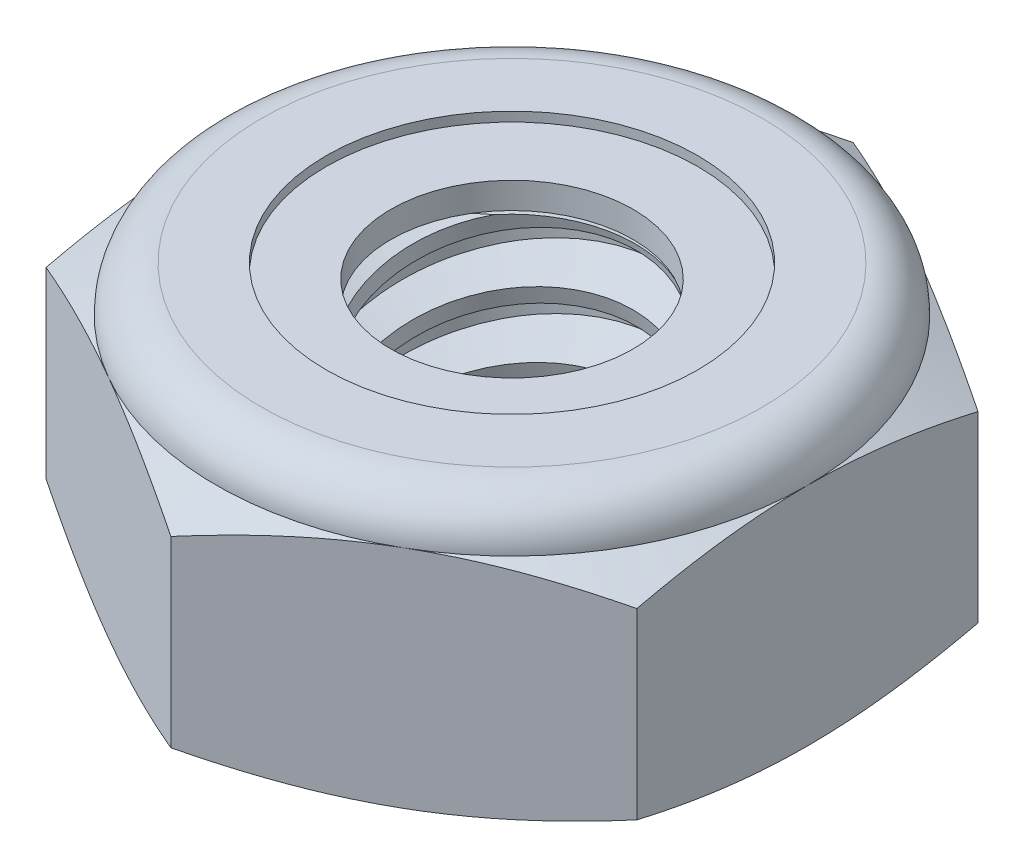
from build123d import *

# Parameters (mm, degrees)
EXTRUDE1_DEPTH       = 4.365625
SKETCH2_W            = 2.413
SKETCH2_H            = 4.365625
LPATTERN1_COUNT      = 4
LPATTERN1_PITCH      = 1.058333333
LPATTERN1_COUNT_DIR2 = 2
LPATTERN1_PITCH_DIR2 = 1.058333333


with BuildPart() as part:
    # Sketch1 → Extrude1 (new body)
    with BuildSketch(Plane(origin=(0, 0, 0), x_dir=(1, 0, 0), z_dir=(0, 1, 0))):
        Polygon((0, 5.499261314), (-4.7625, 2.749630657), (-4.7625, -2.749630657), (0, -5.499261314), (4.7625, -2.749630657), (4.7625, 2.749630657), align=None)
    extrude(amount=EXTRUDE1_DEPTH)

    # Sketch4 → Cut-Revolve2 (revolve, cut)
    with BuildSketch(Plane(origin=(0, 0, 0), x_dir=(0, 0, -1), z_dir=(1, 0, 0))):
        Polygon((0, 4.365625), (2.413, 4.365625), (1.952639712, 4.150955472), (1.952639712, 0.214669528), (2.413, 0), (0, 0), align=None)
    revolve(axis=Axis((0, 4.365625, 0), (0, 1, 0)), mode=Mode.SUBTRACT)


with BuildPart() as body_2:
    # Sketch2 → Revolve1 (revolve)
    with BuildSketch(Plane(origin=(0, 0, 0), x_dir=(0, 0, -1), z_dir=(1, 0, 0))):
        with Locations((1.2065, 2.1828125)):
            Rectangle(SKETCH2_W, SKETCH2_H)
    revolve(axis=Axis((0, -2.413, 0), (0, 1, 0)))

    # Sketch3 → Cut-Revolve1 (revolve, cut)
    with BuildSketch(Plane(origin=(0, 0, 0), x_dir=(0, 0, -1), z_dir=(1, 0, 0))):
        Polygon((2.441337922, 4.236404076), (2.639703376, 3.331857607), (2.009315556, 3.532203115), (1.952639712, 3.790644964), align=None)
    cut_revolve1 = revolve(axis=Axis((0, 4.365625, 0.249698658), (0, -0.9767880883448261, -0.2142079141107075)), mode=Mode.SUBTRACT)

    # LPattern1: Cut-Revolve1 4 × 2
    with Locations(*[Vector(0, -1, 0) * (i * LPATTERN1_PITCH) + Vector(0, 1, 0) * (j * LPATTERN1_PITCH_DIR2) for i in range(LPATTERN1_COUNT) for j in range(LPATTERN1_COUNT_DIR2) if (i, j) != (0, 0)]):
        add(cut_revolve1, mode=Mode.SUBTRACT)


with BuildPart() as part_1:
    add(part.part)

    # Combine1: cut body 2
    add(body_2.part, mode=Mode.SUBTRACT)

    # Sketch5 → Cut-Revolve3 (revolve, cut)
    with BuildSketch(Plane(origin=(0, 0, 0), x_dir=(0, 0, -1), z_dir=(1, 0, 0))):
        with BuildLine():
            Line((0, 0), (4.7625, 0))
            Line((4.7625, 0), (5.499261314, 0.343557443))
            Line((5.499261314, 0.343557443), (5.499261314, 3.29446339))
            Line((5.499261314, 3.29446339), (4.7625, 3.638020833))
            ThreePointArc((4.7625, 3.638020833), (4.549389674, 4.152514674), (4.034895833, 4.365625))
            Line((4.034895833, 4.365625), (4.034895833, 5.635625))
            Line((4.034895833, 5.635625), (6.769261314, 5.635625))
            Line((6.769261314, 5.635625), (6.769261314, -1.27))
            Line((6.769261314, -1.27), (0, -1.27))
            Line((0, -1.27), (0, 0))
        make_face()
    revolve(axis=Axis((0, 0, 0), (0, 1, 0)), mode=Mode.SUBTRACT)

    # Sketch6 → Cut-Revolve4 (revolve, cut)
    with BuildSketch(Plane(origin=(0, 0, 0), x_dir=(0, 0, -1), z_dir=(1, 0, 0))):
        with BuildLine():
            Line((0, 3.638020833), (4.6101, 3.638020833))
            ThreePointArc((4.6101, 3.638020833), (4.4416266, 4.0447516), (4.034895833, 4.213225))
            Line((4.034895833, 4.213225), (2.993767772, 4.213225))
            Line((2.993767772, 4.213225), (2.993767772, 5.635625))
            Line((2.993767772, 5.635625), (0, 5.635625))
            Line((0, 5.635625), (0, 3.638020833))
        make_face()
    revolve(axis=Axis((0, 5.635625, 0), (0, 1, 0)), mode=Mode.SUBTRACT)


with BuildPart() as body_2_2:
    # Sketch7 → Revolve2 (revolve)
    with BuildSketch(Plane(origin=(0, 0, 0), x_dir=(0, 0, -1), z_dir=(1, 0, 0))):
        with BuildLine():
            Line((1.952639712, 3.714220833), (4.528047654, 3.714220833))
            ThreePointArc((4.528047654, 3.714220833), (4.359688876, 4.016854092), (4.034895833, 4.137025))
            Line((4.034895833, 4.137025), (1.952639712, 4.137025))
            Line((1.952639712, 4.137025), (1.952639712, 3.714220833))
        make_face()
    revolve(axis=Axis((0, 3.714220833, 0), (0, 1, 0)))


solid = Compound([part_1.part, body_2_2.part])
